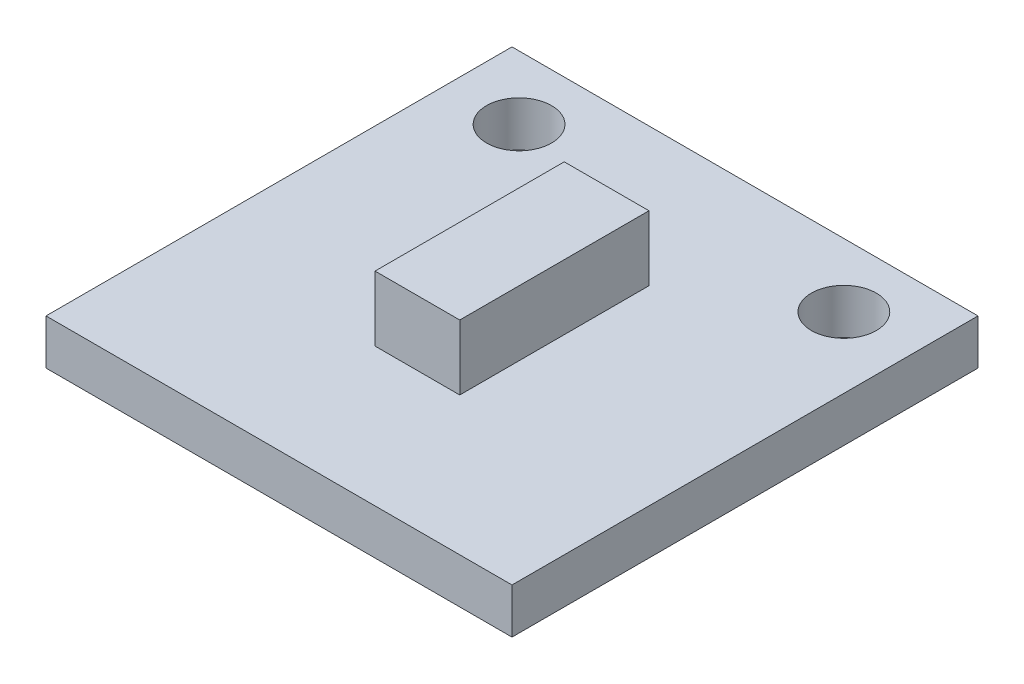
from build123d import *

# Parameters (mm, degrees)
SKETCH1_W           = 16.5
SKETCH1_H           = 16.5
SKETCH1_R           = 1.15
BOSS_EXTRUDE1_DEPTH = 1.6
SKETCH2_W           = 3
SKETCH2_H           = 6.7
BOSS_EXTRUDE2_DEPTH = 2.3


with BuildPart() as part:
    # Sketch1 → Boss-Extrude1 (new body)
    with BuildSketch(Plane(origin=(0, 0, 0), x_dir=(1, 0, 0), z_dir=(0, 1, 0))):
        Rectangle(SKETCH1_W, SKETCH1_H)
        with Locations(Location((-5.75, 6, 0), (0, 0, 270))):
            Circle(SKETCH1_R, mode=Mode.SUBTRACT)
        with Locations(Location((5.75, 6, 0), (0, 0, 270))):
            Circle(SKETCH1_R, mode=Mode.SUBTRACT)
    extrude(amount=BOSS_EXTRUDE1_DEPTH)

    # Sketch2 → Boss-Extrude2 (add)
    with BuildSketch(Plane(origin=(0, 1.6, 0), x_dir=(1, 0, 0), z_dir=(0, 1, 0))):
        Rectangle(SKETCH2_W, SKETCH2_H)
    extrude(amount=BOSS_EXTRUDE2_DEPTH)


solid = part.part
